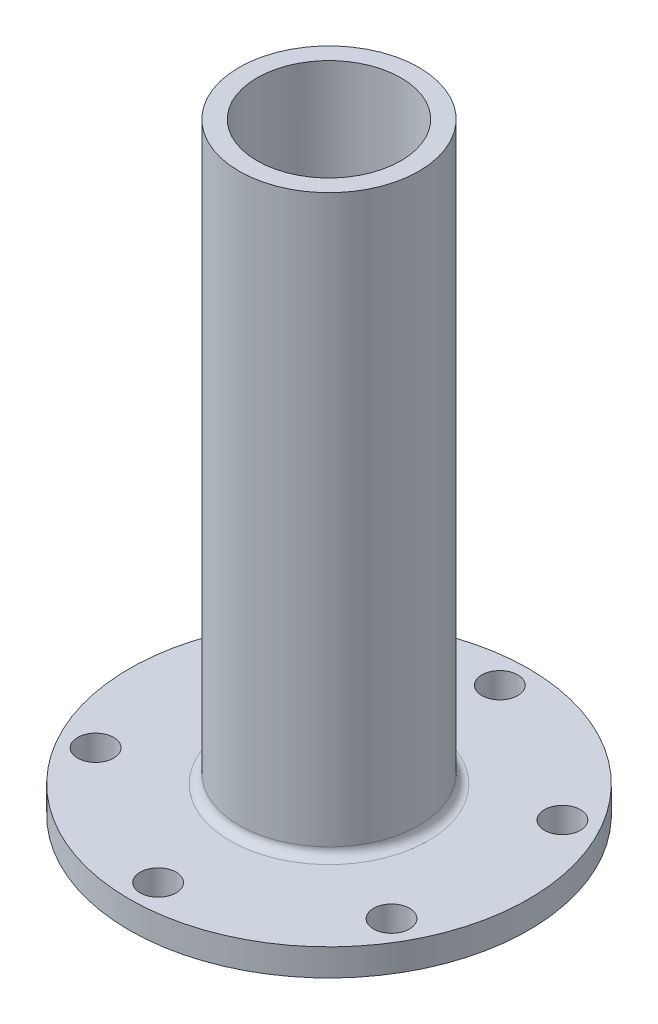
from build123d import *
from build123d.topology import SkipClean

# Parameters (mm, degrees)
SKETCH1_R           = 15.875
SKETCH1_R_2         = 12.7
BOSS_EXTRUDE1_DEPTH = 101.6
BOSS_EXTRUDE2_START = 4.7625
SKETCH2_R           = 35.2425
SKETCH2_R_2         = 12.7
BOSS_EXTRUDE2_DEPTH = 4.7625
FILLET1_R           = 1.5875
SKETCH3_R           = 3.175
CUT_EXTRUDE1_DEPTH  = 4.7625


with BuildPart() as part:
    # Sketch1 → Boss-Extrude1 (new body)
    with BuildSketch(Plane(origin=(0, 0, 0), x_dir=(1, 0, 0), z_dir=(0, 1, 0))):
        with Locations(Location((0, 0, 0), (0, 0, 270))):
            Circle(SKETCH1_R)
        with Locations(Location((0, 0, 0), (0, 0, 270))):
            Circle(SKETCH1_R_2, mode=Mode.SUBTRACT)
    extrude(amount=BOSS_EXTRUDE1_DEPTH)

    # Sketch2 → Boss-Extrude2 (add)
    with SkipClean():  # the faces are left unmerged after this step: merging them gives an invalid solid
        with BuildSketch(Plane(origin=(0, 0, 0), x_dir=(-1, 0, 0), z_dir=(0, -1, 0)).offset(BOSS_EXTRUDE2_START)):
            with Locations(Location((0, 0, 0), (0, 0, 270))):
                Circle(SKETCH2_R)
            with Locations(Location((0, 0, 0), (0, 0, 90))):
                Circle(SKETCH2_R_2, mode=Mode.SUBTRACT)
        extrude(amount=-BOSS_EXTRUDE2_DEPTH)

    # Fillet1
    fillet1_edges = [part.edges().sort_by_distance(p)[0] for p in [
        (0, 0, -15.875),
    ]]
    fillet(fillet1_edges, radius=FILLET1_R)

    # Sketch3 → Cut-Extrude1 (cut)
    with SkipClean():  # the faces are left unmerged after this step: merging them gives an invalid solid
        with BuildSketch(Plane(origin=(0, -4.7625, 0), x_dir=(-1, 0, 0), z_dir=(0, -1, 0))):
            with Locations(Location((0, -30.1625, 0), (0, 0, 90))):
                Circle(SKETCH3_R)
            with Locations(Location((-26.121491242, -15.08125, 0), (0, 0, 90))):
                Circle(SKETCH3_R)
            with Locations(Location((-26.121491242, 15.08125, 0), (0, 0, 90))):
                Circle(SKETCH3_R)
            with Locations(Location((0, 30.1625, 0), (0, 0, 90))):
                Circle(SKETCH3_R)
            with Locations(Location((26.121491242, 15.08125, 0), (0, 0, 90))):
                Circle(SKETCH3_R)
            with Locations(Location((26.121491242, -15.08125, 0), (0, 0, 90))):
                Circle(SKETCH3_R)
        extrude(amount=-CUT_EXTRUDE1_DEPTH, mode=Mode.SUBTRACT)


solid = part.part
